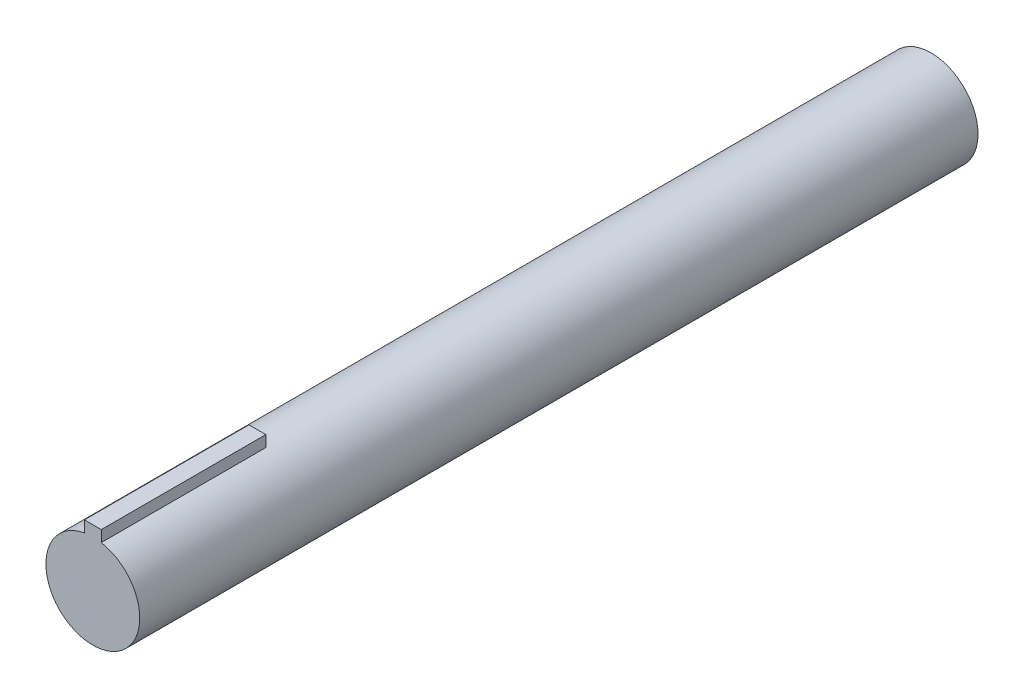
from build123d import *

# Parameters (mm, degrees)
SALIENTE_EXTRUIR1_DEPTH = 8.77
SALIENTE_EXTRUIR2_START = 25.9
CROQUIS2_R              = 2.5
SALIENTE_EXTRUIR2_DEPTH = 25.9
SALIENTE_EXTRUIR6_START = 10
CROQUIS3_R              = 2.5
SALIENTE_EXTRUIR6_DEPTH = 10
CORTAR_EXTRUIR1_DEPTH   = 10


with BuildPart() as part:
    # Croquis1 → Saliente-Extruir1 (new body)
    with BuildSketch(Plane.XY):
        with BuildLine():
            Line((-53.549500652, 10.469715541), (-53.549500652, 11.069715541))
            Line((-53.549500652, 11.069715541), (-52.649500652, 11.069715541))
            Line((-52.649500652, 11.069715541), (-52.649500652, 10.469715541))
            ThreePointArc((-52.649500652, 10.469715541), (-53.099500652, 5.510549015), (-53.549500652, 10.469715541))
        make_face()
    extrude(amount=SALIENTE_EXTRUIR1_DEPTH)

    # Croquis2 → Saliente-Extruir2 (add)
    with BuildSketch(Plane(origin=(0, 0, 0), x_dir=(-1, 0, 0), z_dir=(0, 0, -1)).offset(SALIENTE_EXTRUIR2_START)):
        with Locations((53.099500652, 8.010549015)):
            Circle(CROQUIS2_R)
    extrude(amount=-SALIENTE_EXTRUIR2_DEPTH)

    # Croquis3 → Saliente-Extruir6 (add)
    with BuildSketch(Plane(origin=(0, 0, -25.9), x_dir=(-1, 0, 0), z_dir=(0, 0, -1)).offset(SALIENTE_EXTRUIR6_START)):
        with Locations((53.099500652, 8.010549015)):
            Circle(CROQUIS3_R)
    extrude(amount=-SALIENTE_EXTRUIR6_DEPTH)

    # Croquis8 → Cortar-Extruir1 (cut)
    with BuildSketch(Plane(origin=(0, 0, -35.9), x_dir=(-1, 0, 0), z_dir=(0, 0, -1))):
        with BuildLine():
            Line((52.649500652, 6.15138249), (52.649500652, 5.55138249))
            ThreePointArc((52.649500652, 5.55138249), (53.099500652, 5.510549014), (53.549500652, 5.55138249))
            Line((53.549500652, 5.55138249), (53.549500652, 6.15138249))
            Line((53.549500652, 6.15138249), (52.649500652, 6.15138249))
        make_face()
    extrude(amount=-CORTAR_EXTRUIR1_DEPTH, mode=Mode.SUBTRACT)


solid = part.part
